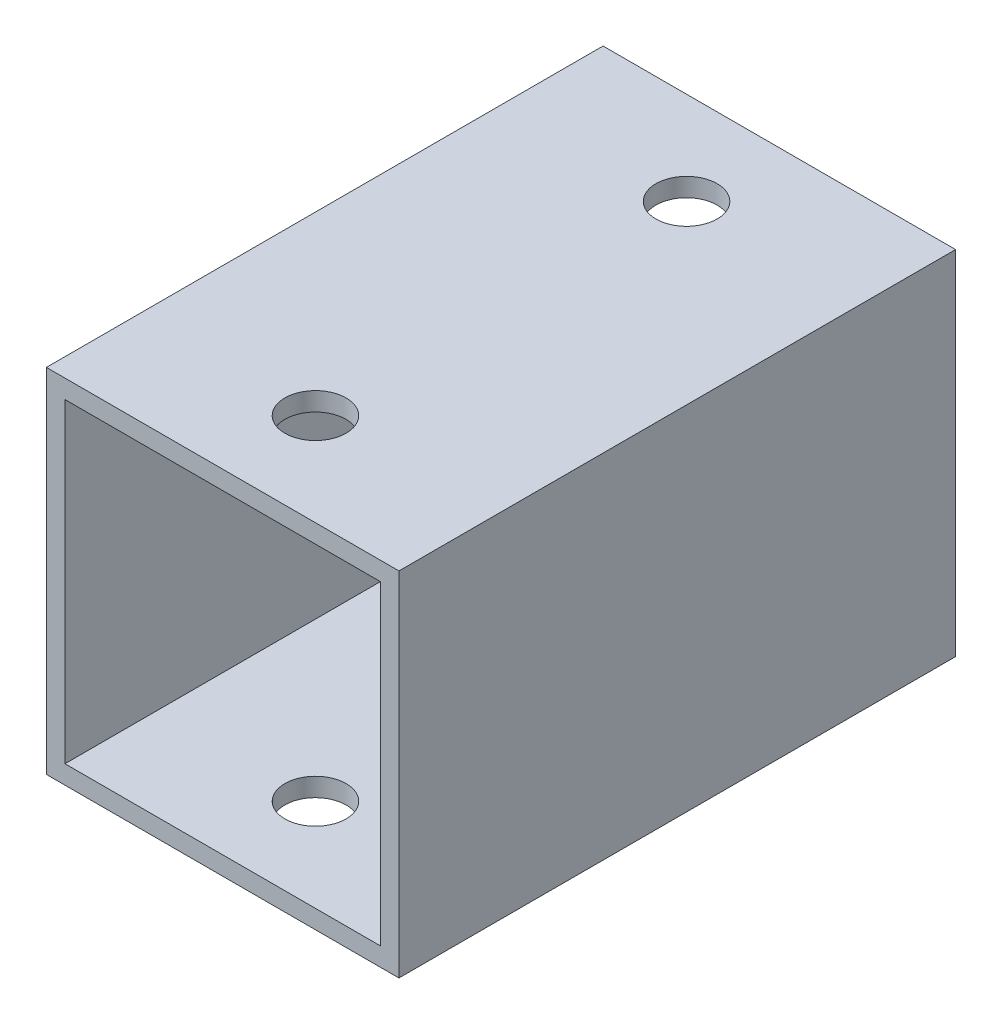
from build123d import *

# Parameters (mm, degrees)
ESBO_O1_W                = 19
ESBO_O1_H                = 19
RESSALTO_EXTRUS_O1_DEPTH = 30
CASCA1_T                 = -1
ESBO_O2_R                = 1.65
CORTE_EXTRUS_O1_DEPTH    = 41.274061131


with BuildPart() as part:
    # Esboço1 → Ressalto-extrusão1 (new body)
    with BuildSketch(Plane.XY):
        with Locations((9.5, 9.5)):
            Rectangle(ESBO_O1_W, ESBO_O1_H)
    extrude(amount=RESSALTO_EXTRUS_O1_DEPTH)

    # Casca1
    casca1_openings = [part.faces().sort_by_distance(p)[0] for p in [
        (9.5, 9.5, 30),
        (9.5, 9.5, 0),
    ]]
    offset(amount=CASCA1_T, openings=casca1_openings, kind=Kind.INTERSECTION)

    # Esboço2 → Corte-extrusão1 (cut, through all)
    with BuildSketch(Plane(origin=(0, 19, 0), x_dir=(1, 0, 0), z_dir=(0, 1, 0))):
        with Locations(Location((9.5, -25, 0), (0, 0, 270))):
            Circle(ESBO_O2_R)
        with Locations(Location((9.5, -5, 0), (0, 0, 270))):
            Circle(ESBO_O2_R)
    extrude(amount=-CORTE_EXTRUS_O1_DEPTH, mode=Mode.SUBTRACT)


solid = part.part
